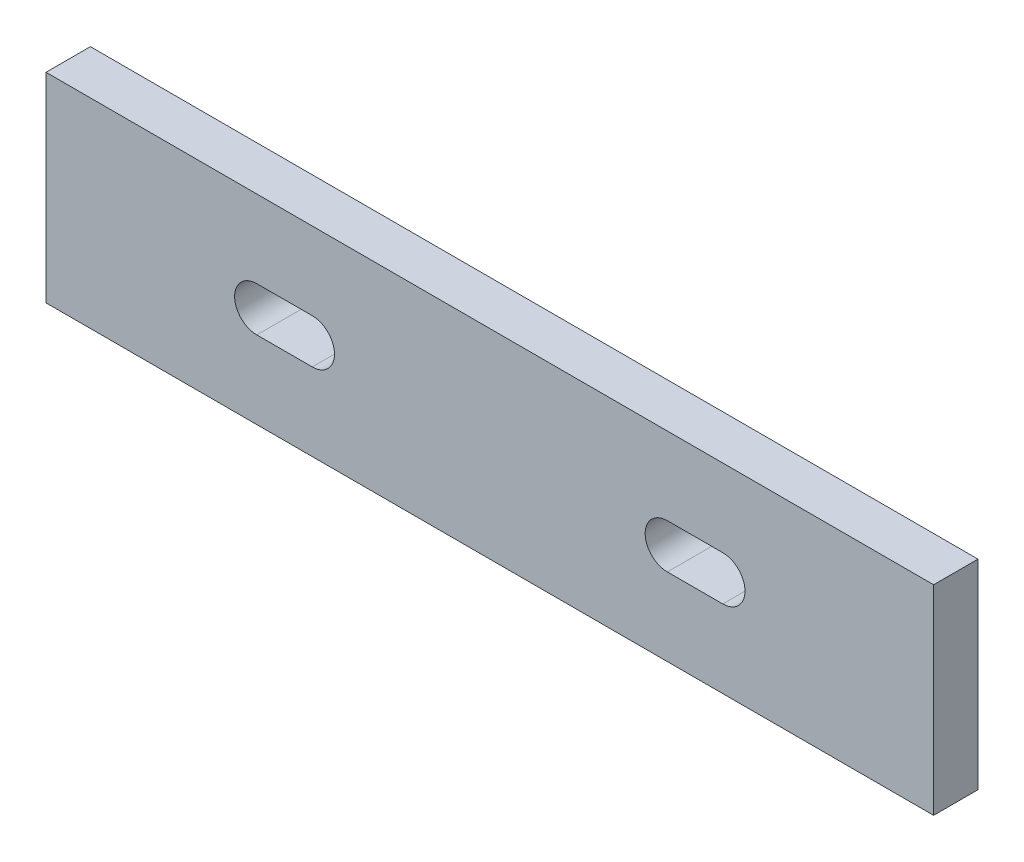
from build123d import *

# Parameters (mm, degrees)
SKETCH2_W           = 400
SKETCH2_H           = 90
BOSS_EXTRUDE1_DEPTH = 20


with BuildPart() as part:
    # Sketch2 → Boss-Extrude1 (new body)
    with BuildSketch(Plane.XY):
        with Locations((2.508250825, -33.877887789)):
            Rectangle(SKETCH2_W, SKETCH2_H)
        with BuildLine():
            Line((107.508250825, -43.877887789), (82.508250825, -43.877887789))
            ThreePointArc((82.508250825, -43.877887789), (72.508250825, -33.877887789), (82.508250825, -23.877887789))
            Line((82.508250825, -23.877887789), (107.508250825, -23.877887789))
            ThreePointArc((107.508250825, -23.877887789), (117.508250825, -33.877887789), (107.508250825, -43.877887789))
        make_face(mode=Mode.SUBTRACT)
        with BuildLine():
            Line((-77.491749175, -43.877887789), (-102.491749175, -43.877887789))
            ThreePointArc((-102.491749175, -43.877887789), (-112.491749175, -33.877887789), (-102.491749175, -23.877887789))
            Line((-102.491749175, -23.877887789), (-77.491749175, -23.877887789))
            ThreePointArc((-77.491749175, -23.877887789), (-67.491749175, -33.877887789), (-77.491749175, -43.877887789))
        make_face(mode=Mode.SUBTRACT)
    extrude(amount=BOSS_EXTRUDE1_DEPTH)


solid = part.part
